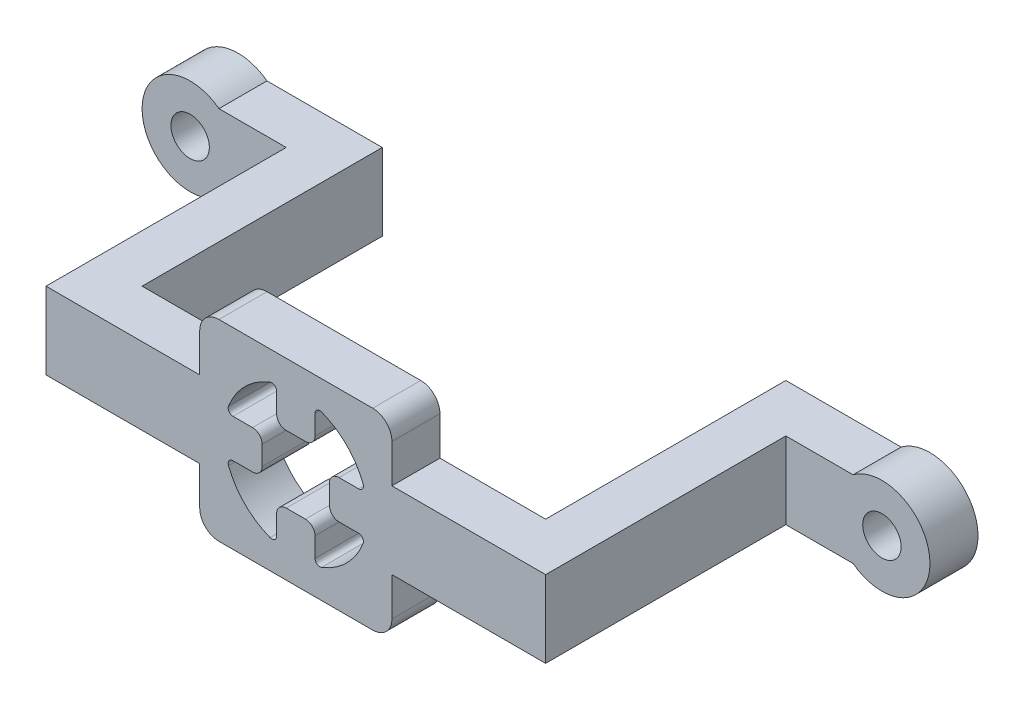
from build123d import *

# Parameters (mm, degrees)
SKETCH_1_R          = 5
EXTRUDE_1_DEPTH     = 5
SKETCH_3_W          = 5
SKETCH_3_H          = 8
EXTRUDE_2_DEPTH     = 15
SKETCH_2_R          = 2
CUT_EXTRUDE_1_DEPTH = 30
SKETCH_6_W          = 5
SKETCH_6_H          = 8
EXTRUDE_4_DEPTH     = 25
SKETCH_7_W          = 5
SKETCH_7_H          = 8
EXTRUDE_5_DEPTH     = 21
SKETCH_8_W          = 20
SKETCH_8_H          = 20
EXTRUDE_6_DEPTH     = 5
FILLET_2_R          = 2
SKETCH_9_R          = 7.5
CUT_EXTRUDE_3_DEPTH = 5
SKETCH_10_W         = 4
SKETCH_10_H         = 4
EXTRUDE_7_DEPTH     = 5
FILLET_3_R          = 1
FILLET_4_R          = 0.5


with BuildPart() as part:
    # 草图1 → 凸台-拉伸1 (new body)
    with BuildSketch(Plane.XY):
        Circle(SKETCH_1_R)
    extrude(amount=EXTRUDE_1_DEPTH)

    # 草图3 → 凸台-拉伸2 (add)
    with BuildSketch(Plane(origin=(0, 0, 0), x_dir=(0, 0, -1), z_dir=(1, 0, 0))):
        with Locations((-2.5, 0)):
            Rectangle(SKETCH_3_W, SKETCH_3_H)
    extrude(amount=EXTRUDE_2_DEPTH)

    # 草图2 → 切除-拉伸1 (cut)
    with BuildSketch(Plane.XY.offset(5)):
        Circle(SKETCH_2_R)
    extrude(amount=-CUT_EXTRUDE_1_DEPTH, mode=Mode.SUBTRACT)

    # 草图6 → 凸台-拉伸4 (add)
    with BuildSketch(Plane.XY.offset(5)):
        with Locations((12.5, 0)):
            Rectangle(SKETCH_6_W, SKETCH_6_H)
    extrude(amount=EXTRUDE_4_DEPTH)

    # 草图7 → 凸台-拉伸5 (add)
    with BuildSketch(Plane(origin=(15, 0, 0), x_dir=(0, 0, -1), z_dir=(1, 0, 0))):
        with Locations((-27.5, 0)):
            Rectangle(SKETCH_7_W, SKETCH_7_H)
    extrude(amount=EXTRUDE_5_DEPTH)

    # 镜向2: part across plane


with BuildPart() as part_1:
    add(part.part)
    add(part.part.mirror(Plane(origin=(36, 0, 0), x_dir=(0, 0, 1), z_dir=(1, 0, 0))))

    # 草图8 → 凸台-拉伸6 (add)
    with BuildSketch(Plane.XY.offset(30)):
        with Locations((36, 0)):
            Rectangle(SKETCH_8_W, SKETCH_8_H)
    extrude(amount=-EXTRUDE_6_DEPTH)

    # 圆角2
    fillet_2_edges = [part_1.edges().sort_by_distance(p)[0] for p in [
        (26, -10, 27.5),
        (46, 10, 27.5),
        (26, 10, 27.5),
        (46, -10, 27.5),
    ]]
    fillet(fillet_2_edges, radius=FILLET_2_R)

    # 草图9 → 切除-拉伸3 (cut)
    with BuildSketch(Plane.XY.offset(30)):
        with Locations((36, 0)):
            Circle(SKETCH_9_R)
    extrude(amount=-CUT_EXTRUDE_3_DEPTH, mode=Mode.SUBTRACT)

    # 草图10 → 凸台-拉伸7 (add)
    with BuildSketch(Plane.XY.offset(30)):
        with Locations((36, 5.5)):
            Rectangle(SKETCH_10_W, SKETCH_10_H)
        with Locations((41.5, 0)):
            Rectangle(SKETCH_10_W, SKETCH_10_H)
        with Locations((36, -5.5)):
            Rectangle(SKETCH_10_W, SKETCH_10_H)
        with Locations((30.5, 0)):
            Rectangle(SKETCH_10_W, SKETCH_10_H)
    extrude(amount=-EXTRUDE_7_DEPTH)

    # 圆角3
    fillet_3_edges = [part_1.edges().sort_by_distance(p)[0] for p in [
        (34, 3.5, 27.5),
        (38, 3.5, 27.5),
        (39.5, 2, 27.5),
        (39.5, -2, 27.5),
        (38, -3.5, 27.5),
        (34, -3.5, 27.5),
        (32.5, -2, 27.5),
        (32.5, 2, 27.5),
    ]]
    fillet(fillet_3_edges, radius=FILLET_3_R)

    # 圆角4
    fillet_4_edges = [part_1.edges().sort_by_distance(p)[0] for p in [
        (38, 7.228416147, 27.5),
        (34, 7.228416147, 27.5),
        (43.228416147, -2, 27.5),
        (43.228416147, 2, 27.5),
        (34, -7.228416147, 27.5),
        (38, -7.228416147, 27.5),
        (28.771583853, 2, 27.5),
        (28.771583853, -2, 27.5),
    ]]
    fillet(fillet_4_edges, radius=FILLET_4_R)


solid = part_1.part
